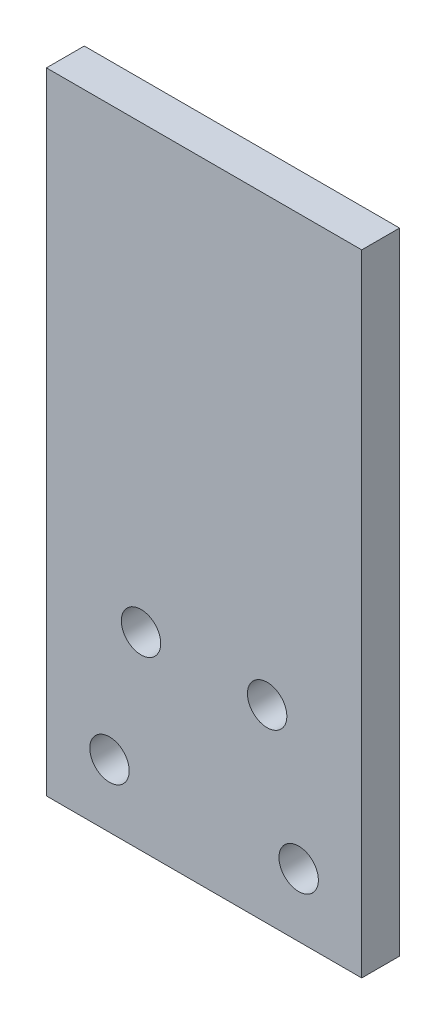
from build123d import *

# Parameters (mm, degrees)
SKETCH2_W                   = 63.5
SKETCH2_H                   = 127
BOSS_EXTRUDE1_DEPTH         = 3.81
TAP_DRILL_FOR_3_8_16_TAP1_D = 7.9375


with BuildPart() as part:
    # Sketch2 → Boss-Extrude1 (new, symmetric)
    with BuildSketch(Plane.XY):
        Rectangle(SKETCH2_W, SKETCH2_H)
    extrude(amount=BOSS_EXTRUDE1_DEPTH, both=True)

    # Tap Drill for 3/8-16 Tap1 (through all)
    with Locations(Plane.XY.offset(3.81)):
        with Locations((-12.7, -25.4), (12.7, -25.4), (-19.05, -50.8), (19.05, -50.8)):
            Hole(TAP_DRILL_FOR_3_8_16_TAP1_D / 2)


solid = part.part
